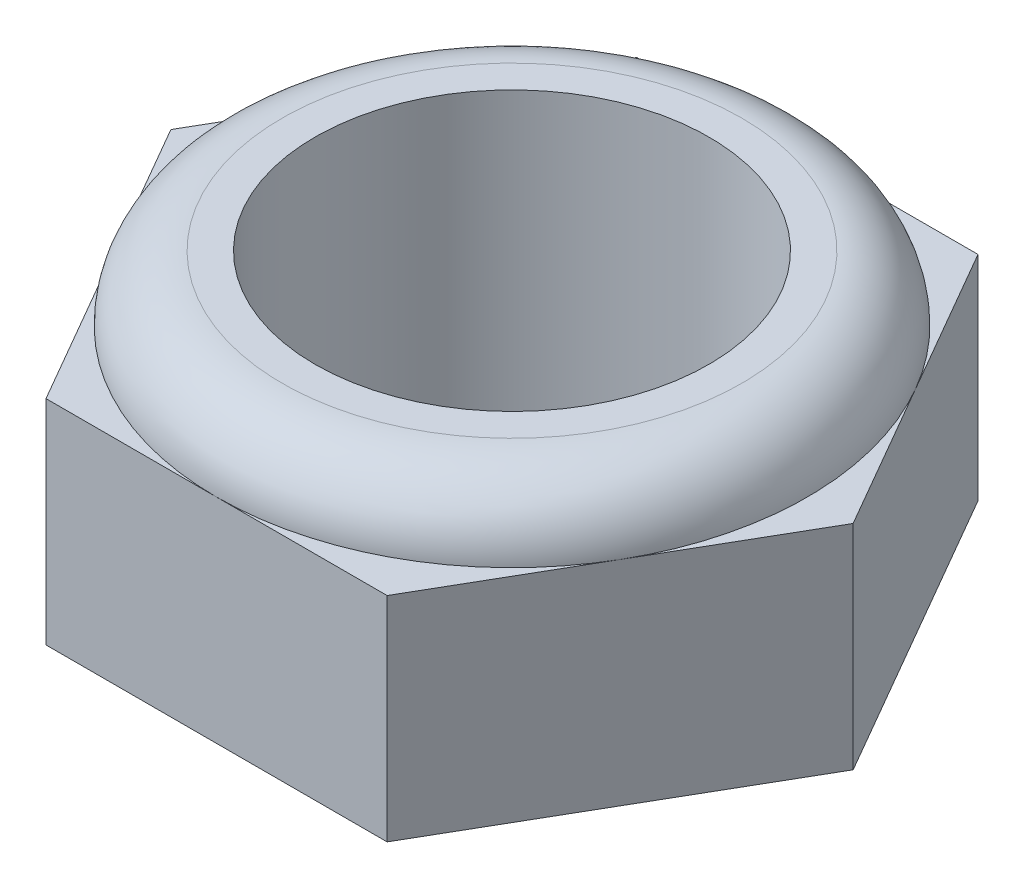
from build123d import *

# Parameters (mm, degrees)
BOSS_EXTRU_1_DEPTH      = 6.746875
ESQUISSE2_R             = 4.7625
ENL_V_MAT_EXTRU_1_DEPTH = 13.829563713


with BuildPart() as part:
    # Esquisse1 → Boss.-Extru.1 (new body)
    with BuildSketch(Plane(origin=(0, 0, 0), x_dir=(1, 0, 0), z_dir=(0, 1, 0))):
        Polygon((4.124445986, 7.14375), (-4.124445986, 7.14375), (-8.248891971, 0), (-4.124445986, -7.14375), (4.124445986, -7.14375), (8.248891971, 0), align=None)
    extrude(amount=BOSS_EXTRU_1_DEPTH)

    # Esquisse2 → Enlèv. mat.-Extru.1 (cut, through all)
    with BuildSketch(Plane(origin=(0, 6.746875, 0), x_dir=(1, 0, 0), z_dir=(0, 1, 0))):
        with Locations(Location((0, 0, 0), (0, 0, 270))):
            Circle(ESQUISSE2_R)
    extrude(amount=-ENL_V_MAT_EXTRU_1_DEPTH, mode=Mode.SUBTRACT)

    # Esquisse3 → Enlèvement de matière-Révolution1 (revolve, cut)
    with BuildSketch(Plane(origin=(0, 0, 0), x_dir=(0, 0, -1), z_dir=(1, 0, 0)), mode=Mode.PRIVATE) as enl_vement_de_mati_re_r_volution1_sk:
        with BuildLine():
            Line((-7.14375, 6.746875), (-6.35, 6.746875))
            Line((-6.35, 6.746875), (-5.55625, 6.746875))
            ThreePointArc((-5.55625, 6.746875), (-6.678782015, 6.281907015), (-7.14375, 5.159375))
            Line((-7.14375, 5.159375), (-8.73125, 5.159375))
            Line((-8.73125, 5.159375), (-8.73125, 6.746875))
            Line((-8.73125, 6.746875), (-7.14375, 6.746875))
        make_face()
    revolve(enl_vement_de_mati_re_r_volution1_sk.sketch.rotate(Axis((0, 0, 0), (0, 1, 0)), 180), axis=Axis((0, 0, 0), (0, 1, 0)), mode=Mode.SUBTRACT)


solid = part.part
